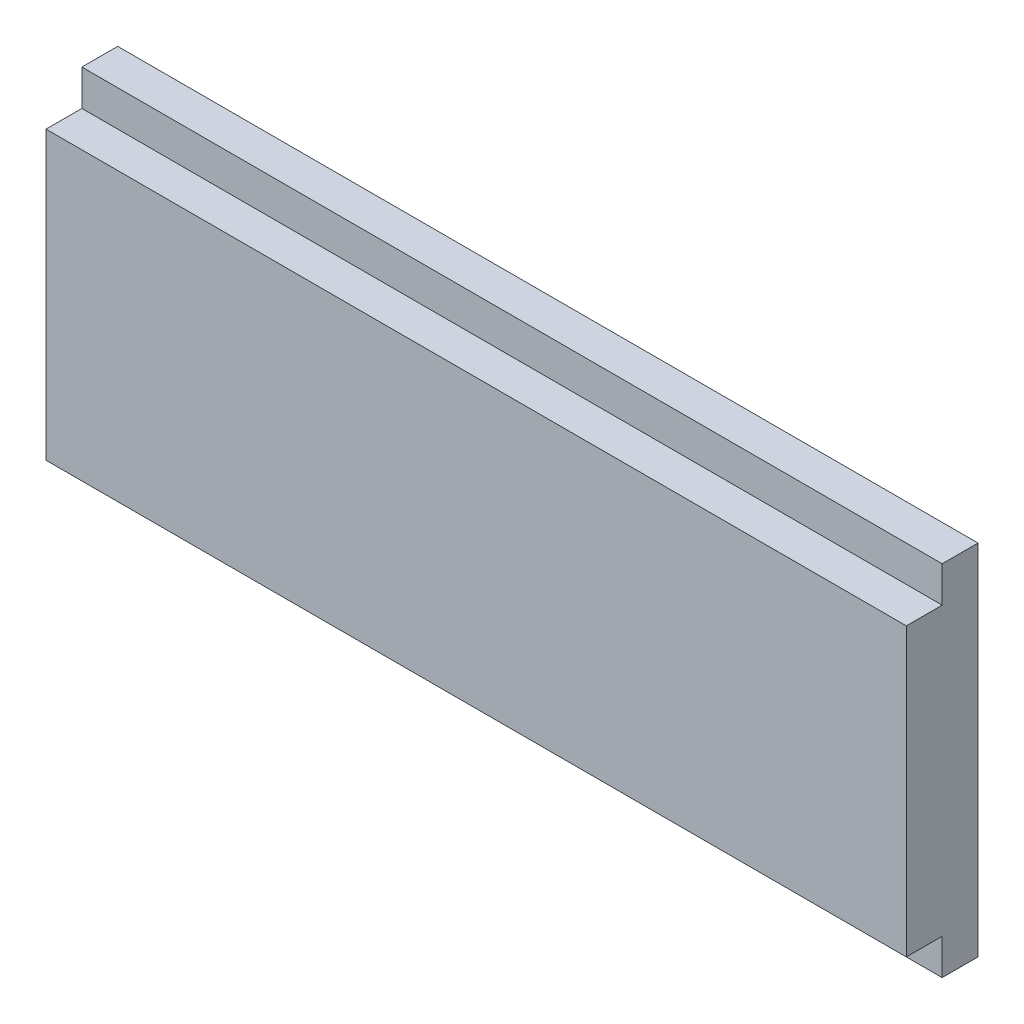
from build123d import *

# Parameters (mm, degrees)
SKETCH_1_W      = 60
SKETCH_1_H      = 25
EXTRUDE_1_DEPTH = 2.5
SKETCH_2_W      = 60
SKETCH_2_H      = 20
EXTRUDE_2_DEPTH = 2.5


with BuildPart() as part:
    # Эскиз1 → Бобышка-Вытянуть1 (new body)
    with BuildSketch(Plane.XY):
        Rectangle(SKETCH_1_W, SKETCH_1_H)
    extrude(amount=EXTRUDE_1_DEPTH)

    # Эскиз2 → Бобышка-Вытянуть2 (add)
    with BuildSketch(Plane.XY.offset(2.5)):
        Rectangle(SKETCH_2_W, SKETCH_2_H)
    extrude(amount=EXTRUDE_2_DEPTH)


solid = part.part
